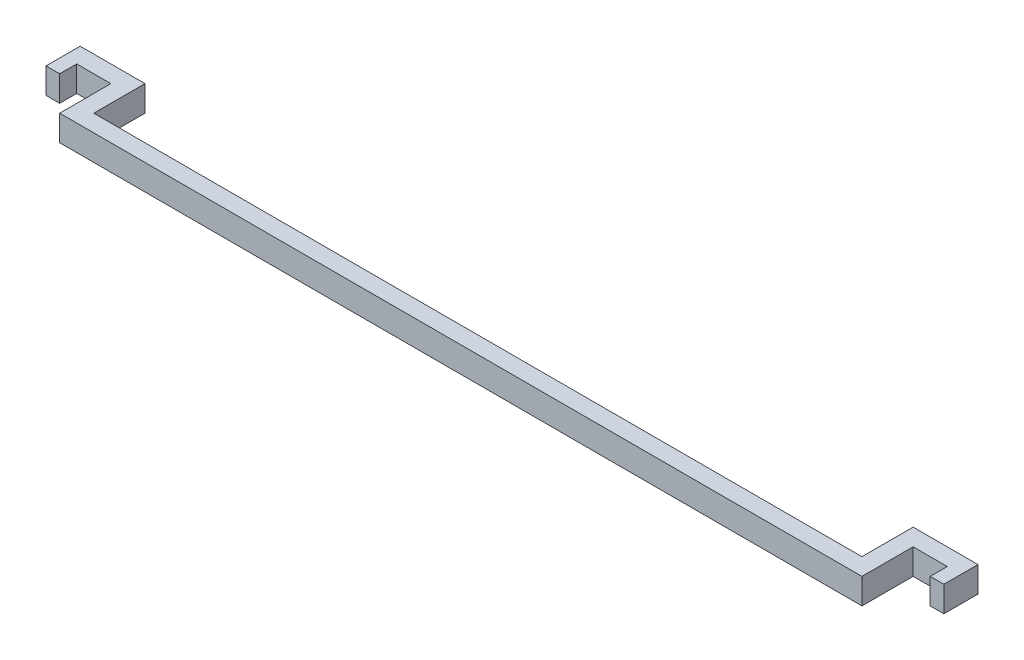
from build123d import *

# Parameters (mm, degrees)
SKETCH_1_W           = 510
SKETCH_1_H           = 15
EXTRUDE_1_DEPTH      = 10
EXTRUDE_2_DEPTH      = 10
EXTRUDE_2_DEPTH_BACK = 10
SKETCH_2_W           = 8
SKETCH_2_H           = 15
EXTRUDE_3_DEPTH      = 15
SKETCH_4_W           = 450
SKETCH_4_H           = 10
CUT_EXTRUDE_1_DEPTH  = 520.758597812


with BuildPart() as part:
    # 草图1 → 凸台-拉伸1 (new body)
    with BuildSketch(Plane.XY):
        with Locations((255, 7.5)):
            Rectangle(SKETCH_1_W, SKETCH_1_H)
    extrude(amount=EXTRUDE_1_DEPTH)

    # 草图2 → 凸台-拉伸2 (add, two sides: drawn at the far end of the back side and taken through both)
    with BuildSketch(Plane.XY.offset(10).offset(-EXTRUDE_2_DEPTH_BACK)):
        with Locations((514, 7.5)):
            Rectangle(SKETCH_2_W, SKETCH_2_H)
        with Locations((-4, 7.5)):
            Rectangle(SKETCH_2_W, SKETCH_2_H)
    extrude(amount=EXTRUDE_2_DEPTH + EXTRUDE_2_DEPTH_BACK)

    # 草图3 → 凸台-拉伸3 (add)
    with BuildSketch(Plane.XZ):
        Polygon((20, 40), (20, 10), (30, 10), (30, 30), (480, 30), (480, 10), (490, 10), (490, 40), align=None)
    extrude(amount=-EXTRUDE_3_DEPTH)

    # 草图4 → 切除-拉伸1 (cut, through all)
    with BuildSketch(Plane.XZ):
        with Locations((255, 5)):
            Rectangle(SKETCH_4_W, SKETCH_4_H)
    extrude(amount=-CUT_EXTRUDE_1_DEPTH, mode=Mode.SUBTRACT)


solid = part.part
